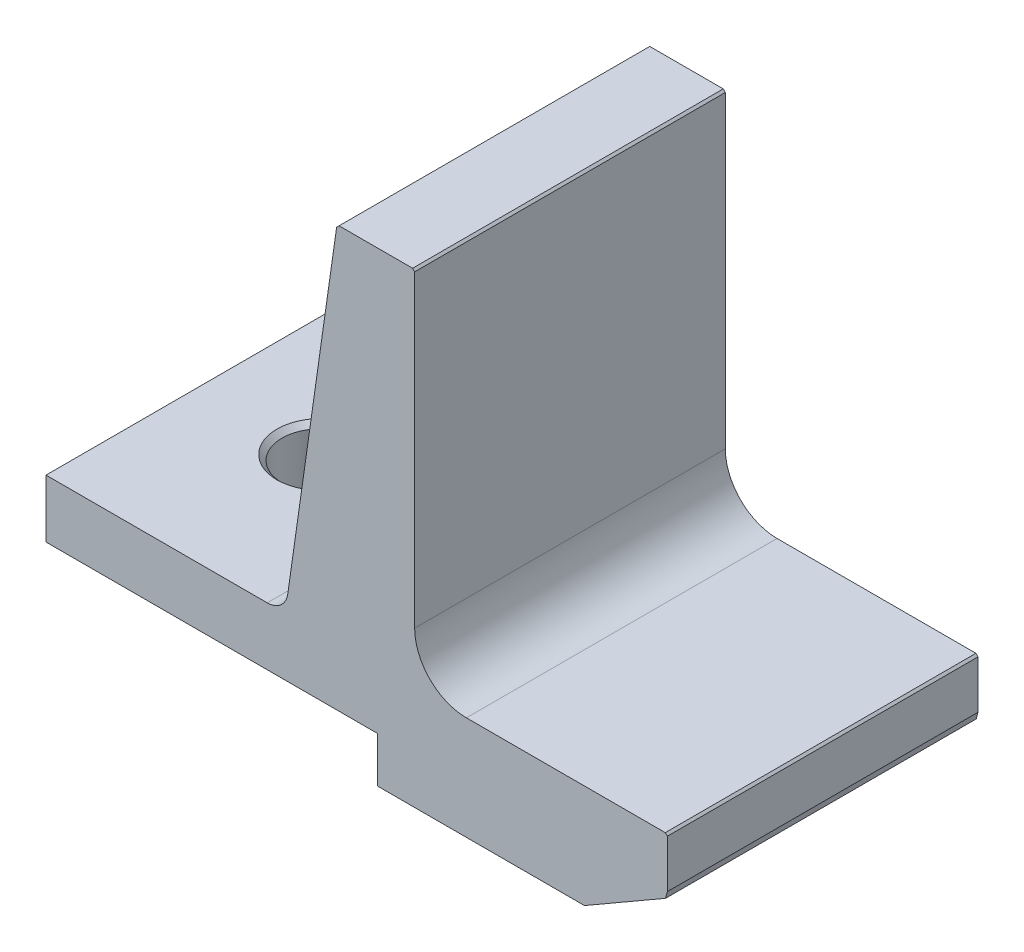
from build123d import *
from OCP.BRepFilletAPI import BRepFilletAPI_MakeChamfer

# Parameters (mm, degrees)
BOSS_EXTRUDE1_DEPTH                    = 38.1
F_3_8_0_375_DIAMETER_HOLE1_D           = 9.525
F_3_8_0_375_DIAMETER_HOLE1_CSINK_D     = 10.795
F_3_8_0_375_DIAMETER_HOLE1_CSINK_ANGLE = 90
CHAMFER1_SIZE                          = 10.16
CHAMFER1_SIZE2                         = 5.865878735
FILLET1_R                              = 2.54
FILLET2_R                              = 6.35
CHAMFER2_SIZE                          = 0.254
CHAMFER2_SIZE2                         = 0.299341871
CHAMFER2_SIZE2_2                       = 0.693940905


with BuildPart() as part:
    # Sketch1 → Boss-Extrude1 (new body)
    with BuildSketch(Plane.XY):
        Polygon((0, 0), (30.988, 0), (30.988, -12.7), (-4.572, -12.7), (-4.572, -7.112), (-45.212, -7.112), (-45.212, 0), (-15.875, 0), (-9.525, 44.45), (0, 44.45), align=None)
    extrude(amount=BOSS_EXTRUDE1_DEPTH)

    # 3/8 (0.375) Diameter Hole1 (through all)
    with Locations(Plane(origin=(0, 0, 0), x_dir=(1, 0, 0), z_dir=(0, 1, 0))):
        with Locations((-30.5435, -19.05)):
            CounterSinkHole(F_3_8_0_375_DIAMETER_HOLE1_D / 2, F_3_8_0_375_DIAMETER_HOLE1_CSINK_D / 2, counter_sink_angle=F_3_8_0_375_DIAMETER_HOLE1_CSINK_ANGLE)

    # Chamfer1
    chamfer1_edges = [part.edges().sort_by_distance(p)[0] for p in [
        (30.988, -12.7, 19.05),
    ]]
    chamfer1_side = [part.faces().sort_by_distance(p)[0] for p in [
        (13.208, -12.7, 19.05),
    ]]
    chamfer(chamfer1_edges, length=CHAMFER1_SIZE, length2=CHAMFER1_SIZE2, reference=chamfer1_side[0])

    # Fillet1
    fillet1_edges = [part.edges().sort_by_distance(p)[0] for p in [
        (-15.875, 0, 19.05),
    ]]
    fillet(fillet1_edges, radius=FILLET1_R)

    # Fillet2
    fillet2_edges = [part.edges().sort_by_distance(p)[0] for p in [
        (0, 0, 19.05),
    ]]
    fillet(fillet2_edges, radius=FILLET2_R)

    # Chamfer2: one chamfer whose edges measure the first distance from different faces: ONE call of the kernel's chamfer builder (chamfer() names one face for all edges)
    chamfer2_edges_1 = [part.edges().sort_by_distance(p)[0] for p in [
        (30.988, 0, 19.05),
        (0, 44.45, 19.05),
    ]]
    chamfer2_edges_2 = [part.edges().sort_by_distance(p)[0] for p in [
        (-9.525, 44.45, 19.05),
    ]]
    chamfer2_side_2 = [part.faces().sort_by_distance(p)[0] for p in [
        (-4.7625, 44.45, 19.05),
    ]]
    chamfer2_edges_3 = [part.edges().sort_by_distance(p)[0] for p in [
        (30.988, -6.834121265, 19.05),
    ]]
    chamfer2_side_3 = [part.faces().sort_by_distance(p)[0] for p in [
        (25.908, -9.767060633, 19.05),
    ]]
    chamfer2 = BRepFilletAPI_MakeChamfer(part.part.solid().wrapped)
    for e in chamfer2_edges_1:
        chamfer2.Add(CHAMFER2_SIZE, e.wrapped)
    for e in chamfer2_edges_2:
        chamfer2.Add(CHAMFER2_SIZE, CHAMFER2_SIZE2, e.wrapped, chamfer2_side_2[0].wrapped)  # the first distance lies on this face
    for e in chamfer2_edges_3:
        chamfer2.Add(CHAMFER2_SIZE, CHAMFER2_SIZE2_2, e.wrapped, chamfer2_side_3[0].wrapped)  # the first distance lies on this face
    add(Compound.cast(chamfer2.Shape()), mode=Mode.REPLACE)


solid = part.part
